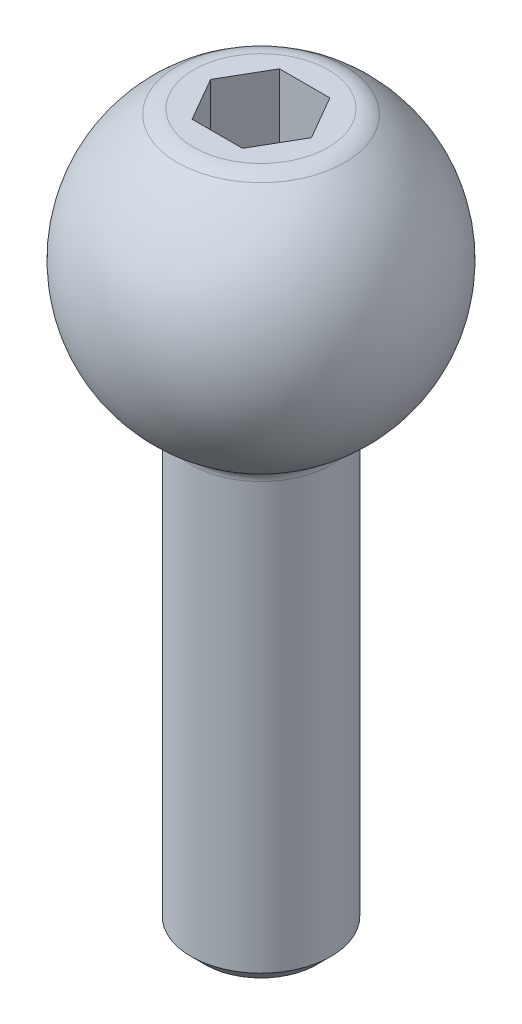
from build123d import *

# Parameters (mm, degrees)
FILLET1_R          = 0.381
CHAMFER1_SIZE      = 0.381
FILLET2_R          = 0.8128
CUT_EXTRUDE1_DEPTH = 2.54


with BuildPart() as part:
    # Sketch1 → Revolve1 (revolve)
    with BuildSketch(Plane.XY):
        with BuildLine():
            Line((-1.905, -3.661588624), (-1.905, -15.875))
            Line((-1.905, -15.875), (0, -15.875))
            Line((0, -15.875), (0, 4.1275))
            ThreePointArc((0, 4.1275), (-4.009330573, 0.980573609), (-1.905, -3.661588624))
        make_face()
    revolve(axis=Axis((0, -101.534252961, 0), (0, 1, 0)))

    # Fillet1
    fillet1_edges = [part.edges().sort_by_distance(p)[0] for p in [
        (1.905, -3.661588624, 0),
    ]]
    fillet(fillet1_edges, radius=FILLET1_R)

    # Chamfer1
    chamfer1_edges = [part.edges().sort_by_distance(p)[0] for p in [
        (1.905, -15.875, 0),
    ]]
    chamfer(chamfer1_edges, length=CHAMFER1_SIZE)

    # SurfaceCut1
    split(bisect_by=Plane(origin=(0, 3.574519854, 0), x_dir=(1, 0, 0), z_dir=(0, 1, 0)), keep=Keep.BOTTOM)

    # Fillet2
    fillet2_edges = [part.edges().sort_by_distance(p)[0] for p in [
        (2.06375, 3.574519854, 0),
    ]]
    fillet(fillet2_edges, radius=FILLET2_R)

    # Sketch3 → Cut-Extrude1 (cut)
    with BuildSketch(Plane(origin=(0, 3.574519854, 0), x_dir=(1, 0, 0), z_dir=(0, 1, 0))):
        Polygon((-0.687407664, -1.190625), (0.687407664, -1.190625), (1.374815329, 0), (0.687407664, 1.190625), (-0.687407664, 1.190625), (-1.374815329, 0), align=None)
    extrude(amount=-CUT_EXTRUDE1_DEPTH, mode=Mode.SUBTRACT)


solid = part.part
